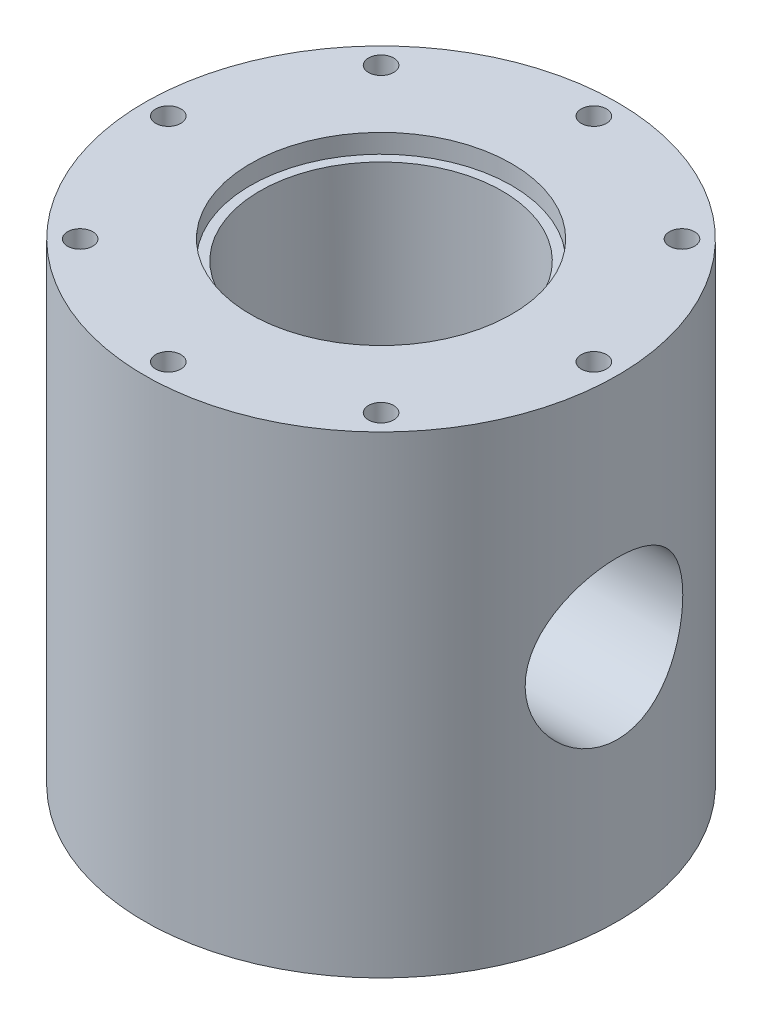
from build123d import *

# Parameters (mm, degrees)
SKETCH1_W           = 75
SKETCH1_H           = 75
BOSS_EXTRUDE1_DEPTH = 75
SKETCH2_R           = 5.35
CUT_EXTRUDE1_DEPTH  = 92.855865354
SKETCH5_R           = 12.5
CUT_EXTRUDE2_DEPTH  = 113.5
SKETCH7_R           = 20.71
SKETCH7_R_2         = 19.21
CUT_EXTRUDE3_DEPTH  = 3
SKETCH11_R          = 2
CUT_EXTRUDE4_DEPTH  = 10
SKETCH12_OUTSIDE_W  = 102.98
SKETCH12_OUTSIDE_H  = 102.98
SKETCH12_OUTSIDE_R  = 37.5
CUT_EXTRUDE6_DEPTH  = 92.855865477
SKETCH13_R          = 19.21
CUT_EXTRUDE7_DEPTH  = 50


with BuildPart() as part:
    # Sketch1 → Boss-Extrude1 (new body)
    with BuildSketch(Plane(origin=(0, 0, 0), x_dir=(1, 0, 0), z_dir=(0, 1, 0))):
        Rectangle(SKETCH1_W, SKETCH1_H)
    extrude(amount=BOSS_EXTRUDE1_DEPTH)

    # Sketch2 → Cut-Extrude1 (cut, through all)
    with BuildSketch(Plane(origin=(0, 0, 0), x_dir=(-1, 0, 0), z_dir=(0, -1, 0))):
        with Locations(Location((0, 0, 0), (0, 0, 90))):
            Circle(SKETCH2_R)
    extrude(amount=-CUT_EXTRUDE1_DEPTH, mode=Mode.SUBTRACT)

    # Sketch5 → Cut-Extrude2 (cut, through all)
    with BuildSketch(Plane(origin=(37.5, 0, 0), x_dir=(0, 0, -1), z_dir=(1, 0, 0))):
        with Locations((0, 37.5)):
            Circle(SKETCH5_R)
    extrude(amount=-CUT_EXTRUDE2_DEPTH, mode=Mode.SUBTRACT)

    # Sketch7 → Cut-Extrude3 (cut)
    with BuildSketch(Plane.XZ):
        with Locations(Location((0, 0, 0), (0, 0, 270))):
            Circle(SKETCH7_R)
        with Locations(Location((0, 0, 0), (0, 0, 270))):
            Circle(SKETCH7_R_2, mode=Mode.SUBTRACT)
    cut_extrude3 = extrude(amount=-CUT_EXTRUDE3_DEPTH, mode=Mode.SUBTRACT)

    # Sketch11 → Cut-Extrude4 (cut)
    with BuildSketch(Plane.XZ):
        with Locations(Location((-33.75, 0, 0), (0, 0, 270))):
            Circle(SKETCH11_R)
        with Locations(Location((-23.864853865, 23.864853865, 0), (0, 0, 270))):
            Circle(SKETCH11_R)
        with Locations(Location((0, 33.75, 0), (0, 0, 270))):
            Circle(SKETCH11_R)
        with Locations(Location((23.864853865, 23.864853865, 0), (0, 0, 270))):
            Circle(SKETCH11_R)
        with Locations(Location((33.75, 0, 0), (0, 0, 270))):
            Circle(SKETCH11_R)
        with Locations(Location((23.864853865, -23.864853865, 0), (0, 0, 270))):
            Circle(SKETCH11_R)
        with Locations(Location((0, -33.75, 0), (0, 0, 270))):
            Circle(SKETCH11_R)
        with Locations(Location((-23.864853865, -23.864853865, 0), (0, 0, 270))):
            Circle(SKETCH11_R)
    cut_extrude4 = extrude(amount=-CUT_EXTRUDE4_DEPTH, mode=Mode.SUBTRACT)

    # Mirror1: Cut-Extrude3, Cut-Extrude4 across plane
    add(cut_extrude3.mirror(Plane.ZX.offset(37.5)), mode=Mode.SUBTRACT)
    add(cut_extrude4.mirror(Plane.ZX.offset(37.5)), mode=Mode.SUBTRACT)

    # Sketch12 outside → Cut-Extrude6 (cut, through all)
    with BuildSketch(Plane.XZ):
        Rectangle(SKETCH12_OUTSIDE_W, SKETCH12_OUTSIDE_H)
        with Locations(Location((0, 0, 0), (0, 0, 270))):
            Circle(SKETCH12_OUTSIDE_R, mode=Mode.SUBTRACT)
    extrude(amount=-CUT_EXTRUDE6_DEPTH, mode=Mode.SUBTRACT)

    # Sketch13 → Cut-Extrude7 (cut)
    with BuildSketch(Plane(origin=(0, 75, 0), x_dir=(1, 0, 0), z_dir=(0, 1, 0))):
        with Locations(Location((0, 0, 0), (0, 0, 90))):
            Circle(SKETCH13_R)
    extrude(amount=-CUT_EXTRUDE7_DEPTH, mode=Mode.SUBTRACT)


solid = part.part
